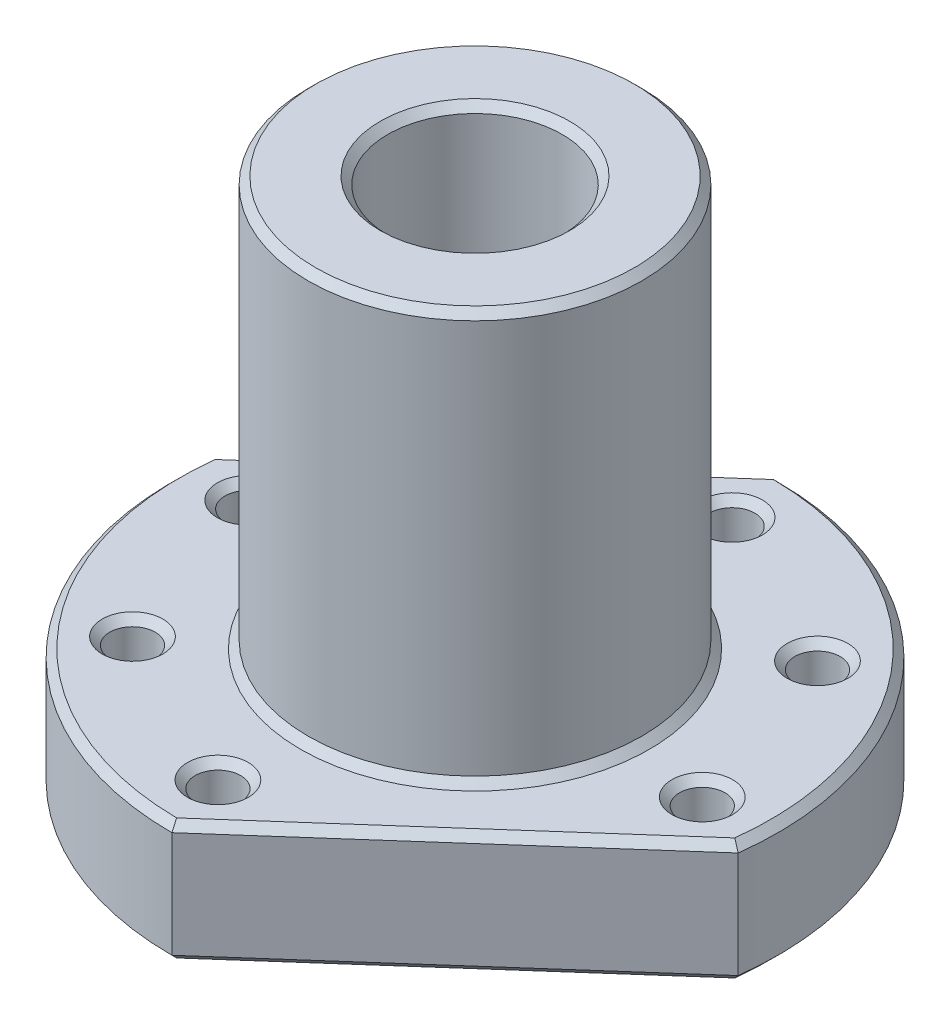
from build123d import *

# Parameters (mm, degrees)
EXTRUDE_1_DEPTH     = 8
SKETCH_2_R          = 11
SKETCH_2_R_2        = 5.75
EXTRUDE_2_DEPTH     = 27
CUT_EXTRUDE_START   = -27
SKETCH_3_R          = 5.75
CUT_EXTRUDE_1_DEPTH = 27
SKETCH_4_R          = 43.168143545
SKETCH_4_R_2        = 20
CUT_EXTRUDE_2_DEPTH = 27
SKETCH_5_R          = 1.5
CUT_EXTRUDE_3_DEPTH = 40.102429592
CHAMFER_1_SIZE      = 0.5


with BuildPart() as part:
    # 草图1 → 凸台-拉伸1 (new body)
    with BuildSketch(Plane(origin=(0, 0, 0), x_dir=(1, 0, 0), z_dir=(0, 1, 0))):
        with BuildLine():
            Line((6.085610762, 25.384237528), (-25.942357498, -2.896249422))
            ThreePointArc((-25.942357498, -2.896249422), (-19.567194229, -17.277704803), (-6.085610762, -25.384237528))
            Line((-6.085610762, -25.384237528), (25.942357498, 2.896249422))
            ThreePointArc((25.942357498, 2.896249422), (19.567194229, 17.277704803), (6.085610762, 25.384237528))
        make_face()
    extrude(amount=EXTRUDE_1_DEPTH)

    # 草图2 → 凸台-拉伸2 (add)
    with BuildSketch(Plane(origin=(0, 8, 0), x_dir=(1, 0, 0), z_dir=(0, 1, 0))):
        with Locations(Location((0, 0, 0), (0, 0, 270))):
            Circle(SKETCH_2_R)
        with Locations(Location((0, 0, 0), (0, 0, 270))):
            Circle(SKETCH_2_R_2, mode=Mode.SUBTRACT)
    extrude(amount=EXTRUDE_2_DEPTH)

    # 草图3 → 切除-拉伸1 (cut)
    with BuildSketch(Plane(origin=(0, 8, 0), x_dir=(1, 0, 0), z_dir=(0, 1, 0)).offset(CUT_EXTRUDE_START)):
        with Locations(Location((0, 0, 0), (0, 0, 270))):
            Circle(SKETCH_3_R)
    extrude(amount=CUT_EXTRUDE_1_DEPTH, mode=Mode.SUBTRACT)

    # 草图4 → 切除-拉伸2 (cut)
    with BuildSketch(Plane(origin=(0, 8, 0), x_dir=(1, 0, 0), z_dir=(0, 1, 0))):
        Circle(SKETCH_4_R)
        Circle(SKETCH_4_R_2, mode=Mode.SUBTRACT)
    extrude(amount=-CUT_EXTRUDE_2_DEPTH, mode=Mode.SUBTRACT)

    # 草图5 → 切除-拉伸3 (cut, through all)
    with BuildSketch(Plane(origin=(0, 8, 0), x_dir=(1, 0, 0), z_dir=(0, 1, 0))):
        with Locations(Location((0.983422311, 15.96974892, 0), (0, 0, 270))):
            Circle(SKETCH_5_R)
        with Locations(Location((11.98770234, 10.59693317, 0), (0, 0, 270))):
            Circle(SKETCH_5_R)
        with Locations(Location((15.96974892, -0.983422311, 0), (0, 0, 270))):
            Circle(SKETCH_5_R)
        with Locations(Location((-0.983422311, -15.96974892, 0), (0, 0, 270))):
            Circle(SKETCH_5_R)
        with Locations(Location((-11.98770234, -10.59693317, 0), (0, 0, 270))):
            Circle(SKETCH_5_R)
        with Locations(Location((-15.96974892, 0.983422311, 0), (0, 0, 270))):
            Circle(SKETCH_5_R)
    extrude(amount=-CUT_EXTRUDE_3_DEPTH, mode=Mode.SUBTRACT)

    # 倒角1
    chamfer_1_edges = [part.edges().sort_by_distance(p)[0] for p in [
        (0, 35, -11),
        (0, 8, -11),
        (0, 35, -5.75),
        (0, 0, -5.75),
        (9.928373368, 0, 11.243994053),
        (-9.928373368, 0, -11.243994053),
        (-14.991992071, 0, 13.237831157),
        (14.991992071, 0, -13.237831157),
        (9.928373368, 8, 11.243994053),
        (-9.928373368, 8, -11.243994053),
        (14.991992071, 8, -13.237831157),
        (-14.991992071, 8, 13.237831157),
        (0.983422311, 0, -17.46974892),
        (0.983422311, 8, -17.46974892),
        (11.98770234, 0, -12.09693317),
        (11.98770234, 8, -12.09693317),
        (15.96974892, 0, -0.516577689),
        (15.96974892, 8, -0.516577689),
        (-0.983422311, 0, 14.46974892),
        (-0.983422311, 8, 14.46974892),
        (-11.98770234, 0, 9.09693317),
        (-11.98770234, 8, 9.09693317),
        (-15.96974892, 0, -2.483422311),
        (-15.96974892, 8, -2.483422311),
    ]]
    chamfer(chamfer_1_edges, length=CHAMFER_1_SIZE)


solid = part.part
